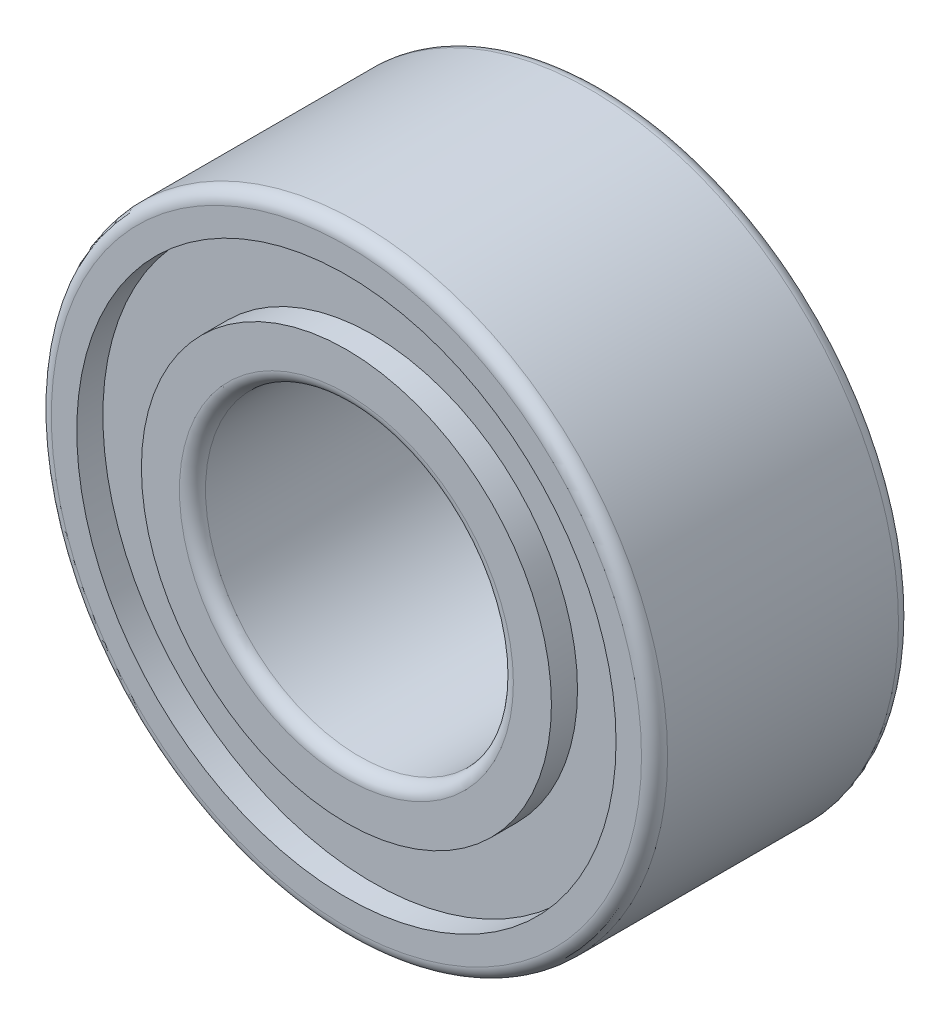
from build123d import *

# Parameters (mm, degrees)
SKETCH1_R          = 2.99974
SKETCH1_R_2        = 1.4986
EXTRUDE1_DEPTH     = 2.5019
FILLET1_R          = 0.127
SKETCH2_R          = 2.625078694
SKETCH2_R_2        = 1.99585199
CUT_EXTRUDE1_DEPTH = 0.254
SKETCH3_R          = 2.62509
SKETCH3_R_2        = 1.9939
CUT_EXTRUDE2_DEPTH = 0.254


with BuildPart() as part:
    # Sketch1 → Extrude1 (new body)
    with BuildSketch(Plane.XY):
        Circle(SKETCH1_R)
        Circle(SKETCH1_R_2, mode=Mode.SUBTRACT)
    extrude(amount=EXTRUDE1_DEPTH)

    # Fillet1
    fillet1_edges = [part.edges().sort_by_distance(p)[0] for p in [
        (-2.99974, 0, 0),
        (-2.99974, 0, 2.5019),
        (-1.4986, 0, 0),
        (-1.4986, 0, 2.5019),
    ]]
    fillet(fillet1_edges, radius=FILLET1_R)

    # Sketch2 → Cut-Extrude1 (cut)
    with BuildSketch(Plane.XY.offset(2.5019)):
        Circle(SKETCH2_R)
        Circle(SKETCH2_R_2, mode=Mode.SUBTRACT)
    extrude(amount=-CUT_EXTRUDE1_DEPTH, mode=Mode.SUBTRACT)

    # Sketch3 → Cut-Extrude2 (cut)
    with BuildSketch(Plane(origin=(0, 0, 0), x_dir=(-1, 0, 0), z_dir=(0, 0, -1))):
        Circle(SKETCH3_R)
        Circle(SKETCH3_R_2, mode=Mode.SUBTRACT)
    extrude(amount=-CUT_EXTRUDE2_DEPTH, mode=Mode.SUBTRACT)


solid = part.part
